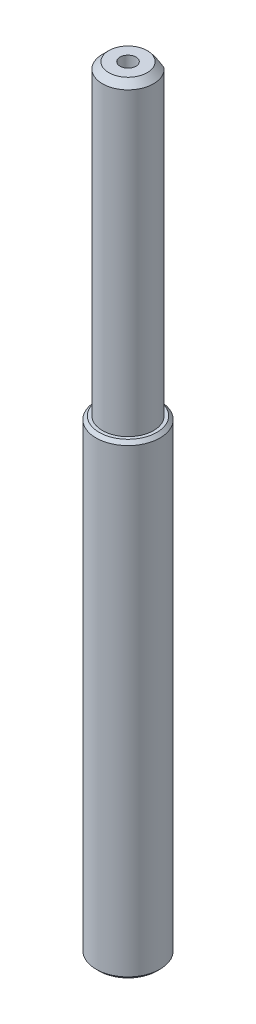
from build123d import *

# Parameters (mm, degrees)
ESQUISSE1_R             = 2
BOSS_EXTRU_1_DEPTH      = 24
ESQUISSE2_R             = 2.5
BOSS_EXTRU_2_DEPTH      = 36.5
CHANFREIN1_SIZE         = 0.5
TROU_TARAUD_M1_61_D     = 1.25
TROU_TARAUD_M1_61_DEPTH = 4.95
TROU_TARAUD_M1_61_TIP   = 0.375537887
ENL_V_START             = -15
ENL_V_MAT_EXTRU_1_DEPTH = 15
CHANFREIN2_SIZE         = 0.25


with BuildPart() as part:
    # Esquisse1 → Boss.-Extru.1 (new body)
    with BuildSketch(Plane(origin=(0, 0, 0), x_dir=(1, 0, 0), z_dir=(0, 1, 0))):
        with Locations(Location((0, 0, 0), (0, 0, 270))):
            Circle(ESQUISSE1_R)
    extrude(amount=BOSS_EXTRU_1_DEPTH)

    # Esquisse2 → Boss.-Extru.2 (add)
    with BuildSketch(Plane.XZ):
        with Locations(Location((0, 0, 0), (0, 0, 270))):
            Circle(ESQUISSE2_R)
    extrude(amount=BOSS_EXTRU_2_DEPTH)

    # Chanfrein1
    chanfrein1_edges = [part.edges().sort_by_distance(p)[0] for p in [
        (0, 24, -2),
    ]]
    chamfer(chanfrein1_edges, length=CHANFREIN1_SIZE)

    # Trou taraudé M1.61
    with Locations(Plane(origin=(0, 24, 0), x_dir=(1, 0, 0), z_dir=(0, 1, 0))):
        with Locations((0, 0)):
            Hole(TROU_TARAUD_M1_61_D / 2, depth=TROU_TARAUD_M1_61_DEPTH)
            with Locations((0, 0, -(TROU_TARAUD_M1_61_DEPTH + TROU_TARAUD_M1_61_TIP / 2))):  # 118° drill point
                Cone(0, TROU_TARAUD_M1_61_D / 2, TROU_TARAUD_M1_61_TIP, mode=Mode.SUBTRACT)

    # Esquisse5 → Enlèv. mat.-Extru.1 (cut)
    with BuildSketch(Plane(origin=(0, 24, 0), x_dir=(1, 0, 0), z_dir=(0, 1, 0)).offset(ENL_V_START)):
        with BuildLine():
            Line((-1.322875656, 1.5), (1.322875656, 1.5))
            ThreePointArc((1.322875656, 1.5), (0, 2), (-1.322875656, 1.5))
        make_face()
    extrude(amount=ENL_V_MAT_EXTRU_1_DEPTH, mode=Mode.SUBTRACT)

    # Chanfrein2
    chanfrein2_edges = [part.edges().sort_by_distance(p)[0] for p in [
        (0, 0, 2.5),
        (0, -36.5, 2.5),
    ]]
    chamfer(chanfrein2_edges, length=CHANFREIN2_SIZE)


solid = part.part
